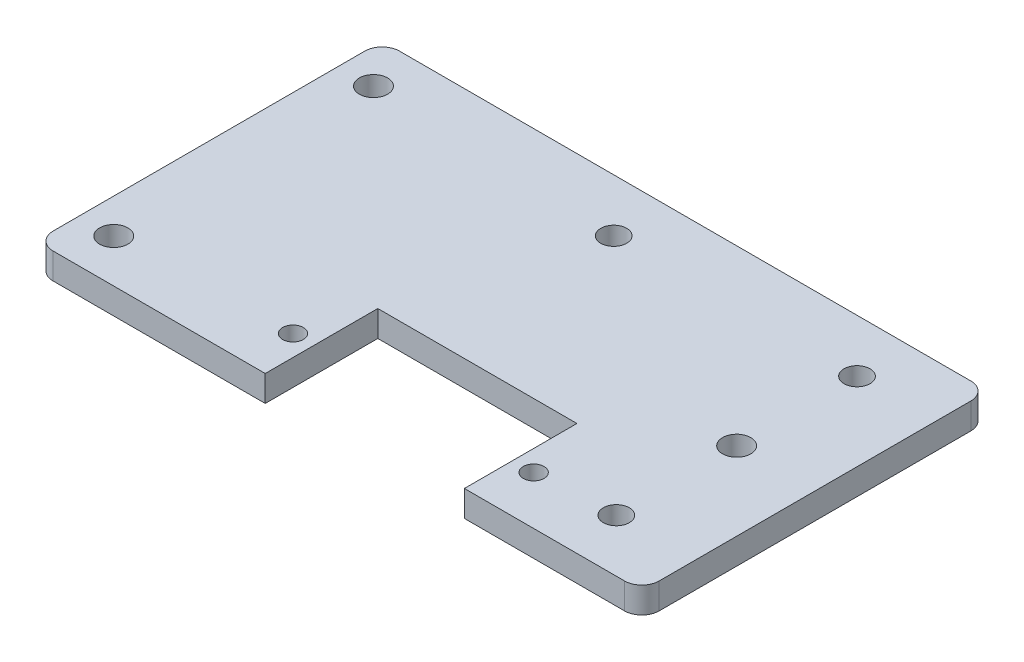
from build123d import *

# Parameters (mm, degrees)
SKETCH1_W             = 70
SKETCH1_H             = 40
BOSS_EXTRUDE1_DEPTH   = 3
F_3_0MM_DOWEL_HOLE1_D = 3
F_4_CLEARANCE_HOLE1_D = 3.2639
M2_CLEARANCE_HOLE1_D  = 2.4
SKETCH8_W             = 23
SKETCH8_H             = 13
CUT_EXTRUDE1_DEPTH    = 10
FILLET1_R             = 2


with BuildPart() as part:
    # Sketch1 → Boss-Extrude1 (new body)
    with BuildSketch(Plane(origin=(0, 0, 0), x_dir=(1, 0, 0), z_dir=(0, 1, 0))):
        Rectangle(SKETCH1_W, SKETCH1_H)
    extrude(amount=BOSS_EXTRUDE1_DEPTH)

    # Ø3.0mm Dowel Hole1 (through all)
    with Locations(Plane(origin=(0, 3, 0), x_dir=(1, 0, 0), z_dir=(0, 1, 0))):
        with Locations((-2.15, 13.9), (25.95, 13.9), (25.95, -13.9)):
            Hole(F_3_0MM_DOWEL_HOLE1_D / 2)

    # #4 Clearance Hole1 (through all)
    with Locations(Plane(origin=(0, 3, 0), x_dir=(1, 0, 0), z_dir=(0, 1, 0))):
        with Locations((-31, 15), (-31, -15), (25.95, 0)):
            Hole(F_4_CLEARANCE_HOLE1_D / 2)

    # M2 Clearance Hole1 (through all)
    with Locations(Plane(origin=(0, 3, 0), x_dir=(1, 0, 0), z_dir=(0, 1, 0))):
        with Locations((-10.9, -14.4), (16.9, -14.4)):
            Hole(M2_CLEARANCE_HOLE1_D / 2)

    # Sketch8 → Cut-Extrude1 (cut)
    with BuildSketch(Plane(origin=(0, 3, 0), x_dir=(1, 0, 0), z_dir=(0, 1, 0))):
        with Locations((3, -13.5)):
            Rectangle(SKETCH8_W, SKETCH8_H)
    extrude(amount=-CUT_EXTRUDE1_DEPTH, mode=Mode.SUBTRACT)

    # Fillet1
    fillet1_edges = [part.edges().sort_by_distance(p)[0] for p in [
        (35, 1.5, 20),
        (-35, 1.5, 20),
        (-35, 1.5, -20),
        (35, 1.5, -20),
    ]]
    fillet(fillet1_edges, radius=FILLET1_R)


solid = part.part
